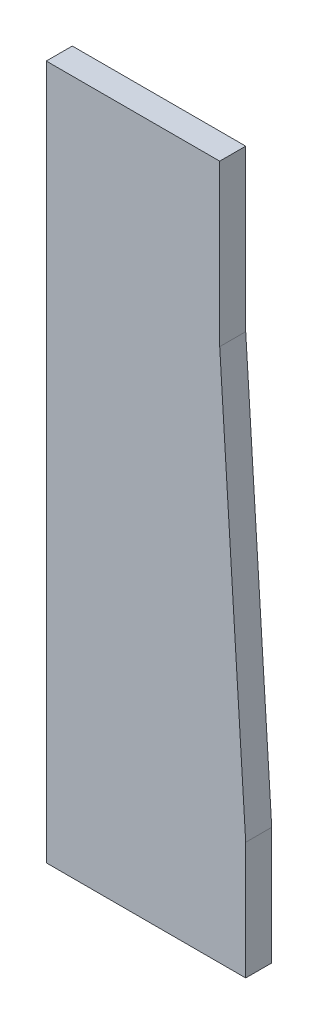
from build123d import *

# Parameters (mm, degrees)
BOSS_EXTRUDE1_DEPTH = 19.05


with BuildPart() as part:
    # Sketch1 → Boss-Extrude1 (new body)
    with BuildSketch(Plane.XY):
        Polygon((82.03946, -5024.878404071), (82.03946, -5533.415502988), (228.088766336, -5533.415502988), (228.088766336, -5447.34166837), (209.03946, -5142.552766987), (209.03946, -5024.878404071), align=None)
    extrude(amount=BOSS_EXTRUDE1_DEPTH)


solid = part.part
